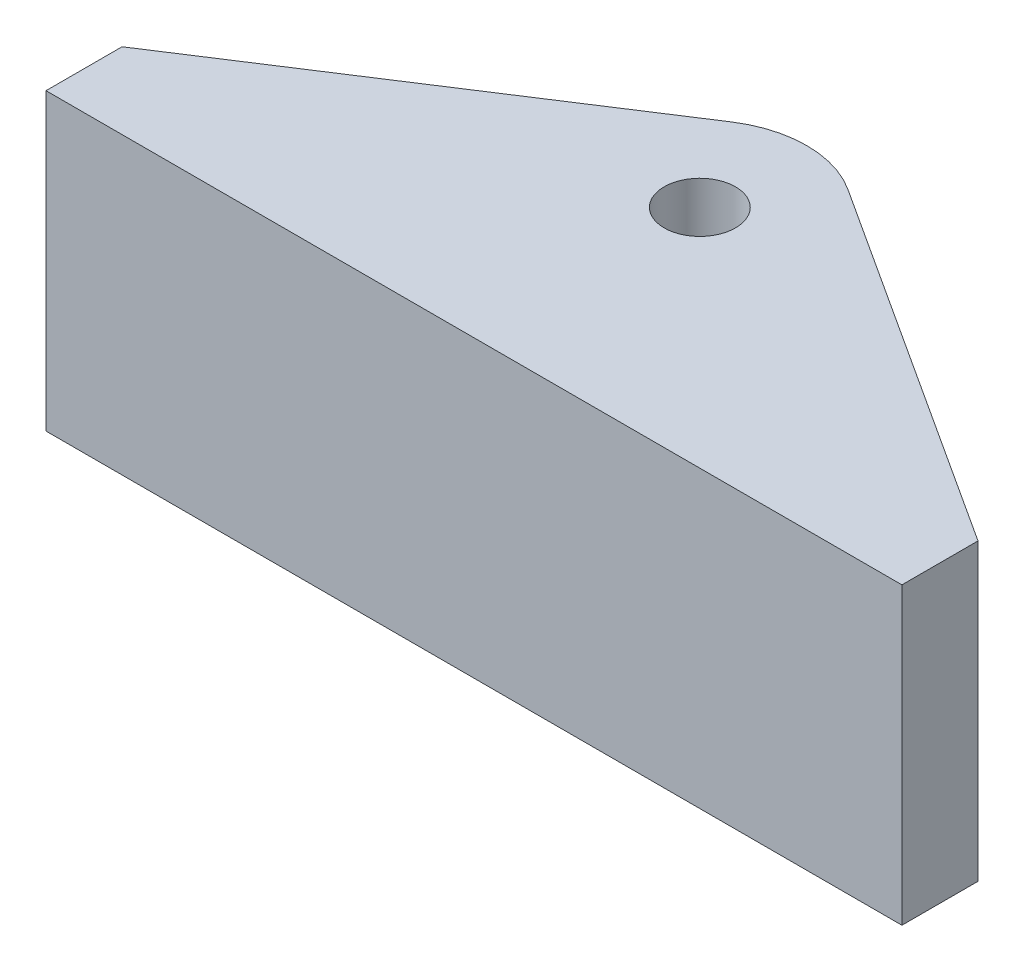
from build123d import *

# Parameters (mm, degrees)
SKETCH1_R           = 2.38125
BOSS_EXTRUDE1_DEPTH = 19.685


with BuildPart() as part:
    # Sketch1 → Boss-Extrude1 (new body)
    with BuildSketch(Plane(origin=(0, 0, 0), x_dir=(1, 0, 0), z_dir=(0, 1, 0))):
        with BuildLine():
            Line((0, 5.08), (24.690664344, 21.076673302))
            ThreePointArc((24.690664344, 21.076673302), (28.575, 22.225), (32.459335656, 21.076673302))
            Line((32.459335656, 21.076673302), (57.15, 5.08))
            Line((57.15, 5.08), (57.15, 0))
            Line((57.15, 0), (0, 0))
            Line((0, 0), (0, 5.08))
        make_face()
        with Locations(Location((28.575, 15.08125, 0), (0, 0, 270))):
            Circle(SKETCH1_R, mode=Mode.SUBTRACT)
    extrude(amount=-BOSS_EXTRUDE1_DEPTH)


solid = part.part
